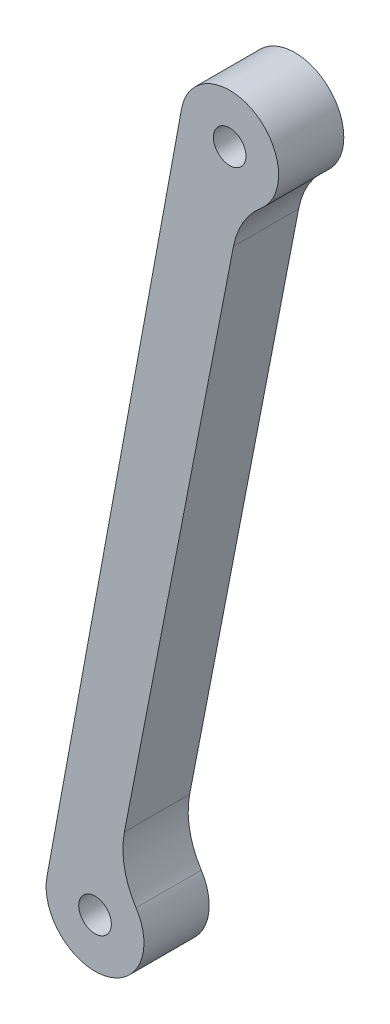
from build123d import *

# Parameters (mm, degrees)
SKETCH7_R           = 1
BOSS_EXTRUDE2_DEPTH = 4


with BuildPart() as part:
    # Sketch7 → Boss-Extrude2 (new body)
    with BuildSketch(Plane.XY):
        with BuildLine():
            Line((14.939494353, 43.671800322), (23.195274145, 88.592442488))
            ThreePointArc((23.195274145, 88.592442488), (27.655886689, 90.642426594), (28.073058509, 85.75106004))
            ThreePointArc((28.073058509, 85.75106004), (26.977195581, 84.457381822), (26.376654335, 82.871863263))
            Line((26.376654335, 82.871863263), (19.693168718, 48.435996906))
            ThreePointArc((19.693168718, 48.435996906), (19.693341996, 46.529807983), (20.406889033, 44.762208802))
            ThreePointArc((20.406889033, 44.762208802), (18.476836527, 40.187465572), (14.939494353, 43.671800322))
        make_face()
        with Locations((17.890076902, 43.129524909)):
            Circle(SKETCH7_R, mode=Mode.SUBTRACT)
        with Locations((26.145856694, 88.050167075)):
            Circle(SKETCH7_R, mode=Mode.SUBTRACT)
    extrude(amount=BOSS_EXTRUDE2_DEPTH)


solid = part.part
